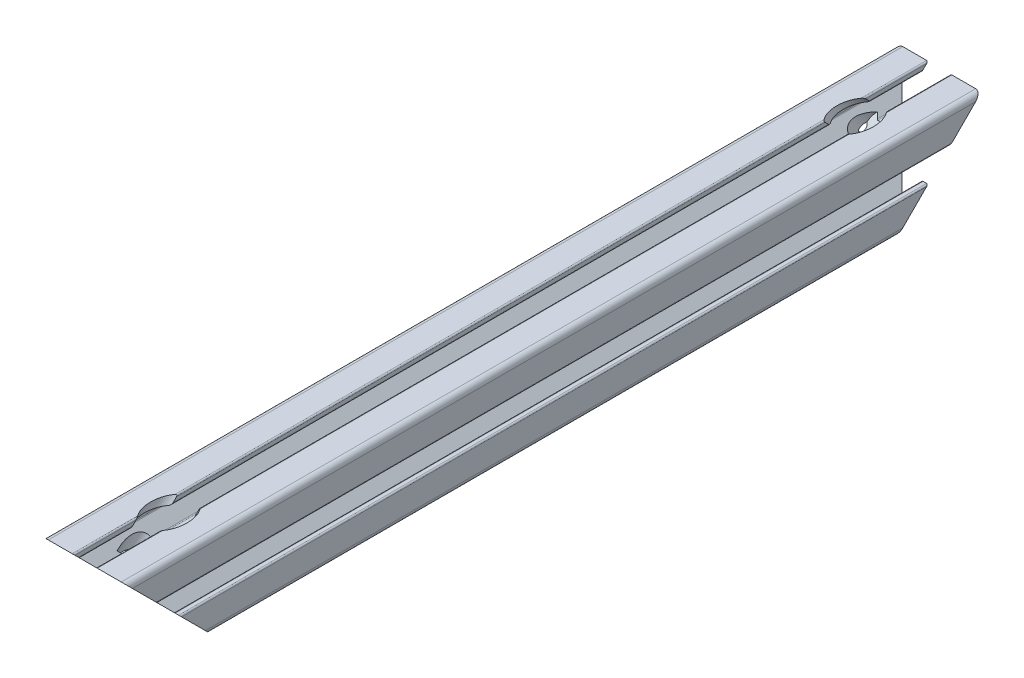
from build123d import *

# Parameters (mm, degrees)
SKETCH1_R               = 3.52998588
BOSS_EXTRUDE1_DEPTH     = 152.4
CUT_EXTRUDE1_DEPTH      = 154.869283484
CUT_EXTRUDE1_DEPTH_BACK = 154.869283484


with BuildPart() as part:
    # Sketch1 → Boss-Extrude1 (new, symmetric)
    with BuildSketch(Plane.XY):
        with BuildLine():
            Line((14.49994, -4), (13.24247465, -4))
            ThreePointArc((13.24247465, -4), (12.88892126, -4.146446609), (12.74247465, -4.5))
            Line((12.74247465, -4.5), (12.74247465, -7.732519321))
            ThreePointArc((12.74247465, -7.732519321), (12.602449697, -8.097296796), (12.242781236, -8.249967))
            Line((12.242781236, -8.249967), (10.260188032, -8.249967))
            ThreePointArc((10.260188032, -8.249967), (10.068847082, -8.211906919), (9.906636056, -8.103520976))
            Line((9.906636056, -8.103520976), (5.981117769, -4.178002689))
            ThreePointArc((5.981117769, -4.178002689), (5.872731827, -4.015791664), (5.834671745, -3.824450713))
            Line((5.834671745, -3.824450713), (5.834671745, -1.01249595))
            Line((5.834671745, -1.01249595), (5.834671745, 0.88749645))
            Line((5.834671745, 0.88749645), (5.834671745, 3.824450713))
            ThreePointArc((5.834671745, 3.824450713), (5.872731827, 4.015791664), (5.981117769, 4.178002689))
            Line((5.981117769, 4.178002689), (9.906636056, 8.103520976))
            ThreePointArc((9.906636056, 8.103520976), (10.068847082, 8.211906919), (10.260188032, 8.249967))
            Line((10.260188032, 8.249967), (12.242781236, 8.249967))
            ThreePointArc((12.242781236, 8.249967), (12.602449697, 8.097296796), (12.74247465, 7.732519321))
            Line((12.74247465, 7.732519321), (12.74247465, 4.5))
            ThreePointArc((12.74247465, 4.5), (12.88892126, 4.146446609), (13.24247465, 4))
            Line((13.24247465, 4), (14.49994, 4))
            ThreePointArc((14.49994, 4), (14.853493391, 4.146446609), (14.99994, 4.5))
            Line((14.99994, 4.5), (14.99994, 12.999948))
            ThreePointArc((14.99994, 12.999948), (14.414155906, 14.414155906), (12.999948, 14.99994))
            Line((12.999948, 14.99994), (4.5, 14.99994))
            ThreePointArc((4.5, 14.99994), (4.146446609, 14.853493391), (4, 14.49994))
            Line((4, 14.49994), (4, 13.24247465))
            ThreePointArc((4, 13.24247465), (4.146446609, 12.88892126), (4.5, 12.74247465))
            Line((4.5, 12.74247465), (7.732519321, 12.74247465))
            ThreePointArc((7.732519321, 12.74247465), (8.097296796, 12.602449697), (8.249967, 12.242781236))
            Line((8.249967, 12.242781236), (8.249967, 10.260188032))
            ThreePointArc((8.249967, 10.260188032), (8.211906919, 10.068847082), (8.103520976, 9.906636056))
            Line((8.103520976, 9.906636056), (4.178002689, 5.981117769))
            ThreePointArc((4.178002689, 5.981117769), (4.015791664, 5.872731827), (3.824450713, 5.834671745))
            Line((3.824450713, 5.834671745), (0.9499962, 5.834671745))
            Line((0.9499962, 5.834671745), (-0.9499962, 5.834671745))
            Line((-0.9499962, 5.834671745), (-3.824450713, 5.834671745))
            ThreePointArc((-3.824450713, 5.834671745), (-4.015791664, 5.872731827), (-4.178002689, 5.981117769))
            Line((-4.178002689, 5.981117769), (-8.103520976, 9.906636056))
            ThreePointArc((-8.103520976, 9.906636056), (-8.211906919, 10.068847082), (-8.249967, 10.260188032))
            Line((-8.249967, 10.260188032), (-8.249967, 12.242781236))
            ThreePointArc((-8.249967, 12.242781236), (-8.097296796, 12.602449697), (-7.732519321, 12.74247465))
            Line((-7.732519321, 12.74247465), (-4.5, 12.74247465))
            ThreePointArc((-4.5, 12.74247465), (-4.146446609, 12.88892126), (-4, 13.24247465))
            Line((-4, 13.24247465), (-4, 14.49994))
            ThreePointArc((-4, 14.49994), (-4.146446609, 14.853493391), (-4.5, 14.99994))
            Line((-4.5, 14.99994), (-12.999948, 14.99994))
            ThreePointArc((-12.999948, 14.99994), (-14.414155906, 14.414155906), (-14.99994, 12.999948))
            Line((-14.99994, 12.999948), (-14.99994, 4.5))
            ThreePointArc((-14.99994, 4.5), (-14.853493391, 4.146446609), (-14.49994, 4))
            Line((-14.49994, 4), (-13.24247465, 4))
            ThreePointArc((-13.24247465, 4), (-12.88892126, 4.146446609), (-12.74247465, 4.5))
            Line((-12.74247465, 4.5), (-12.74247465, 7.732519321))
            ThreePointArc((-12.74247465, 7.732519321), (-12.602449697, 8.097296796), (-12.242781236, 8.249967))
            Line((-12.242781236, 8.249967), (-10.260188032, 8.249967))
            ThreePointArc((-10.260188032, 8.249967), (-10.068847082, 8.211906919), (-9.906636056, 8.103520976))
            Line((-9.906636056, 8.103520976), (-5.981117769, 4.178002689))
            ThreePointArc((-5.981117769, 4.178002689), (-5.872731827, 4.015791664), (-5.834671745, 3.824450713))
            Line((-5.834671745, 3.824450713), (-5.834671745, 0.88749645))
            Line((-5.834671745, 0.88749645), (-5.834671745, -1.01249595))
            Line((-5.834671745, -1.01249595), (-5.834671745, -3.824450713))
            ThreePointArc((-5.834671745, -3.824450713), (-5.872731827, -4.015791664), (-5.981117769, -4.178002689))
            Line((-5.981117769, -4.178002689), (-9.906636056, -8.103520976))
            ThreePointArc((-9.906636056, -8.103520976), (-10.068847082, -8.211906919), (-10.260188032, -8.249967))
            Line((-10.260188032, -8.249967), (-12.242781236, -8.249967))
            ThreePointArc((-12.242781236, -8.249967), (-12.602449697, -8.097296796), (-12.74247465, -7.732519321))
            Line((-12.74247465, -7.732519321), (-12.74247465, -4.5))
            ThreePointArc((-12.74247465, -4.5), (-12.88892126, -4.146446609), (-13.24247465, -4))
            Line((-13.24247465, -4), (-14.49994, -4))
            ThreePointArc((-14.49994, -4), (-14.853493391, -4.146446609), (-14.99994, -4.5))
            Line((-14.99994, -4.5), (-14.99994, -12.999948))
            ThreePointArc((-14.99994, -12.999948), (-14.414155906, -14.414155906), (-12.999948, -14.99994))
            Line((-12.999948, -14.99994), (-4.5, -14.99994))
            ThreePointArc((-4.5, -14.99994), (-4.146446609, -14.853493391), (-4, -14.49994))
            Line((-4, -14.49994), (-4, -13.24247465))
            ThreePointArc((-4, -13.24247465), (-4.146446609, -12.88892126), (-4.5, -12.74247465))
            Line((-4.5, -12.74247465), (-7.732519321, -12.74247465))
            ThreePointArc((-7.732519321, -12.74247465), (-8.097296796, -12.602449697), (-8.249967, -12.242781236))
            Line((-8.249967, -12.242781236), (-8.249967, -10.260188032))
            ThreePointArc((-8.249967, -10.260188032), (-8.211906919, -10.068847082), (-8.103520976, -9.906636056))
            Line((-8.103520976, -9.906636056), (-4.178002689, -5.981117769))
            ThreePointArc((-4.178002689, -5.981117769), (-4.015791664, -5.872731827), (-3.824450713, -5.834671745))
            Line((-3.824450713, -5.834671745), (-0.9499962, -5.834671745))
            Line((-0.9499962, -5.834671745), (0.9499962, -5.834671745))
            Line((0.9499962, -5.834671745), (3.824450713, -5.834671745))
            ThreePointArc((3.824450713, -5.834671745), (4.015791664, -5.872731827), (4.178002689, -5.981117769))
            Line((4.178002689, -5.981117769), (8.103520976, -9.906636056))
            ThreePointArc((8.103520976, -9.906636056), (8.211906919, -10.068847082), (8.249967, -10.260188032))
            Line((8.249967, -10.260188032), (8.249967, -12.242781236))
            ThreePointArc((8.249967, -12.242781236), (8.097296796, -12.602449697), (7.732519321, -12.74247465))
            Line((7.732519321, -12.74247465), (4.5, -12.74247465))
            ThreePointArc((4.5, -12.74247465), (4.146446609, -12.88892126), (4, -13.24247465))
            Line((4, -13.24247465), (4, -14.49994))
            ThreePointArc((4, -14.49994), (4.146446609, -14.853493391), (4.5, -14.99994))
            Line((4.5, -14.99994), (12.999948, -14.99994))
            ThreePointArc((12.999948, -14.99994), (14.414155906, -14.414155906), (14.99994, -12.999948))
            Line((14.99994, -12.999948), (14.99994, -4.5))
            ThreePointArc((14.99994, -4.5), (14.853493391, -4.146446609), (14.49994, -4))
        make_face()
        Circle(SKETCH1_R, mode=Mode.SUBTRACT)
        with BuildLine():
            Line((-12.6999492, -13.6999452), (-9.880960476, -13.6999452))
            ThreePointArc((-9.880960476, -13.6999452), (-9.61155387, -13.58835333), (-9.499962, -13.318946724))
            Line((-9.499962, -13.318946724), (-9.499962, -9.87996048))
            ThreePointArc((-9.499962, -9.87996048), (-9.611260978, -9.611260978), (-9.87996048, -9.499962))
            Line((-9.87996048, -9.499962), (-13.318946724, -9.499962))
            ThreePointArc((-13.318946724, -9.499962), (-13.58835333, -9.61155387), (-13.6999452, -9.880960476))
            Line((-13.6999452, -9.880960476), (-13.6999452, -12.6999492))
            ThreePointArc((-13.6999452, -12.6999492), (-13.407053153, -13.407053153), (-12.6999492, -13.6999452))
        make_face(mode=Mode.SUBTRACT)
        with BuildLine():
            Line((13.6999452, -12.6999492), (13.6999452, -9.880960476))
            ThreePointArc((13.6999452, -9.880960476), (13.58835333, -9.61155387), (13.318946724, -9.499962))
            Line((13.318946724, -9.499962), (9.87996048, -9.499962))
            ThreePointArc((9.87996048, -9.499962), (9.611260978, -9.611260978), (9.499962, -9.87996048))
            Line((9.499962, -9.87996048), (9.499962, -13.318946724))
            ThreePointArc((9.499962, -13.318946724), (9.61155387, -13.58835333), (9.880960476, -13.6999452))
            Line((9.880960476, -13.6999452), (12.6999492, -13.6999452))
            ThreePointArc((12.6999492, -13.6999452), (13.407053153, -13.407053153), (13.6999452, -12.6999492))
        make_face(mode=Mode.SUBTRACT)
        with BuildLine():
            Line((9.87996048, 9.499962), (13.318946724, 9.499962))
            ThreePointArc((13.318946724, 9.499962), (13.58835333, 9.61155387), (13.6999452, 9.880960476))
            Line((13.6999452, 9.880960476), (13.6999452, 12.6999492))
            ThreePointArc((13.6999452, 12.6999492), (13.407053153, 13.407053153), (12.6999492, 13.6999452))
            Line((12.6999492, 13.6999452), (9.880960476, 13.6999452))
            ThreePointArc((9.880960476, 13.6999452), (9.61155387, 13.58835333), (9.499962, 13.318946724))
            Line((9.499962, 13.318946724), (9.499962, 9.87996048))
            ThreePointArc((9.499962, 9.87996048), (9.611260978, 9.611260978), (9.87996048, 9.499962))
        make_face(mode=Mode.SUBTRACT)
        with BuildLine():
            Line((-13.6999452, 12.6999492), (-13.6999452, 9.880960476))
            ThreePointArc((-13.6999452, 9.880960476), (-13.58835333, 9.61155387), (-13.318946724, 9.499962))
            Line((-13.318946724, 9.499962), (-9.87996048, 9.499962))
            ThreePointArc((-9.87996048, 9.499962), (-9.611260978, 9.611260978), (-9.499962, 9.87996048))
            Line((-9.499962, 9.87996048), (-9.499962, 13.318946724))
            ThreePointArc((-9.499962, 13.318946724), (-9.61155387, 13.58835333), (-9.880960476, 13.6999452))
            Line((-9.880960476, 13.6999452), (-12.6999492, 13.6999452))
            ThreePointArc((-12.6999492, 13.6999452), (-13.407053153, 13.407053153), (-13.6999452, 12.6999492))
        make_face(mode=Mode.SUBTRACT)
    extrude(amount=BOSS_EXTRUDE1_DEPTH, both=True)

    # Sketch2 → Cut-Extrude1 (cut, two sides: drawn at the far end of the back side and taken through both)
    with BuildSketch(Plane(origin=(0, 0, 0), x_dir=(0, 0, -1), z_dir=(1, 0, 0)).offset(-CUT_EXTRUDE1_DEPTH_BACK)):
        Polygon((-152.4, 14.99994), (-152.4, -14.99994), (-122.40012, -14.99994), align=None)
        Polygon((122.40012, -14.99994), (152.4, 14.99994), (152.4, -14.99994), align=None)
    extrude(amount=CUT_EXTRUDE1_DEPTH + CUT_EXTRUDE1_DEPTH_BACK, mode=Mode.SUBTRACT)

    # Sketch4 → Cut-Revolve1 (revolve, cut)
    with BuildSketch(Plane(origin=(0, 0, 0), x_dir=(0, 0, -1), z_dir=(1, 0, 0))):
        Polygon((-117.803925922, 19.596134078), (-122.40012, 24.192328155), (-137.541481356, 9.050966799), (-135.172673639, 6.682159082), (-139.627446361, 2.227386361), (-137.40006, 0), align=None)
    cut_revolve1 = revolve(axis=Axis((0, -14.99994, 152.4), (0, 0.7071067811865476, -0.7071067811865476)), mode=Mode.SUBTRACT)

    # Mirror1: Cut-Revolve1 across plane
    add(cut_revolve1.mirror(Plane.XY), mode=Mode.SUBTRACT)


solid = part.part
